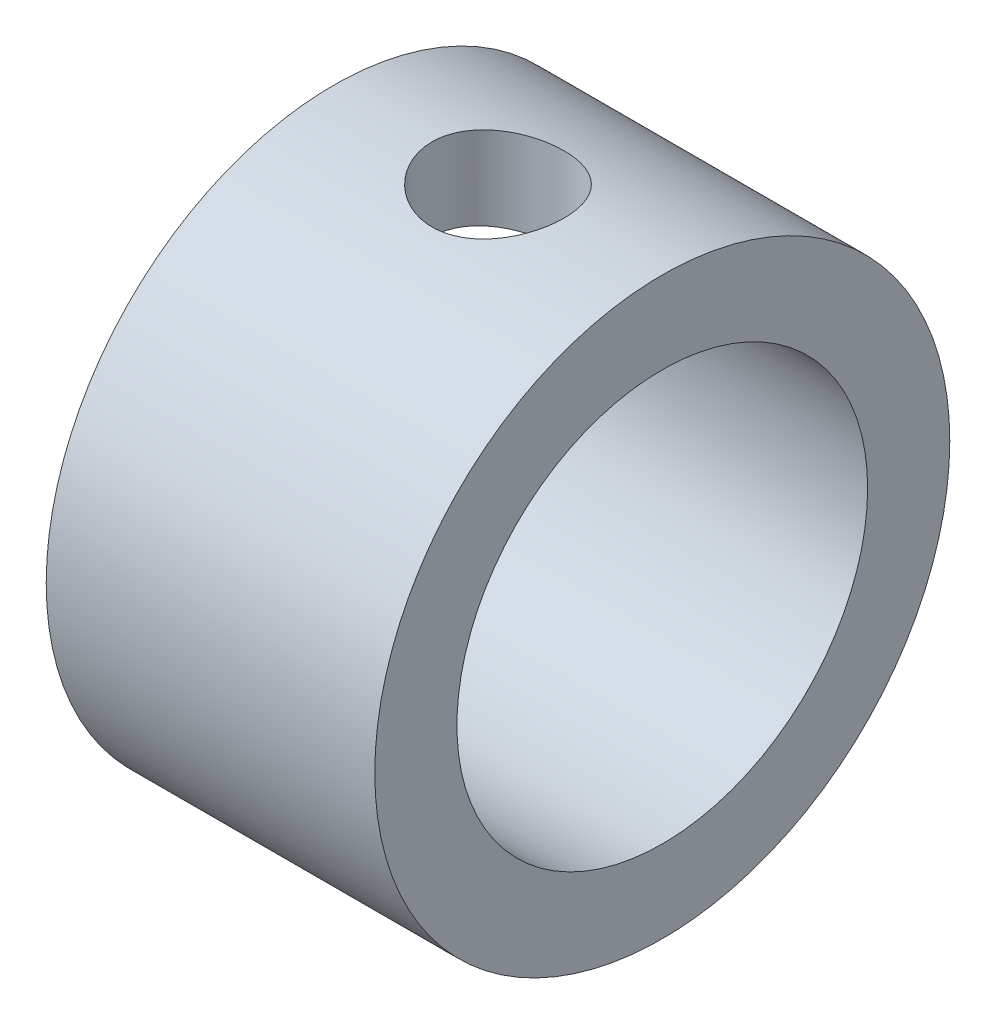
from build123d import *

# Parameters (mm, degrees)
SKETCH1_R           = 11.1125
SKETCH1_R_2         = 7.9375
BOSS_EXTRUDE1_DEPTH = 6.35
SKETCH3_R           = 2.5527
CUT_EXTRUDE2_DEPTH  = 17.949861725


with BuildPart() as part:
    # Sketch1 → Boss-Extrude1 (new, symmetric)
    with BuildSketch(Plane(origin=(0, 0, 0), x_dir=(0, 0, -1), z_dir=(1, 0, 0))):
        Circle(SKETCH1_R)
        Circle(SKETCH1_R_2, mode=Mode.SUBTRACT)
    extrude(amount=BOSS_EXTRUDE1_DEPTH, both=True)

    # Sketch3 → Cut-Extrude2 (cut, through all)
    with BuildSketch(Plane(origin=(0, 0, 0), x_dir=(1, 0, 0), z_dir=(0, 1, 0))):
        with Locations(Location((0, 0, 0), (0, 0, 90))):
            Circle(SKETCH3_R)
    extrude(amount=CUT_EXTRUDE2_DEPTH, mode=Mode.SUBTRACT)


solid = part.part
